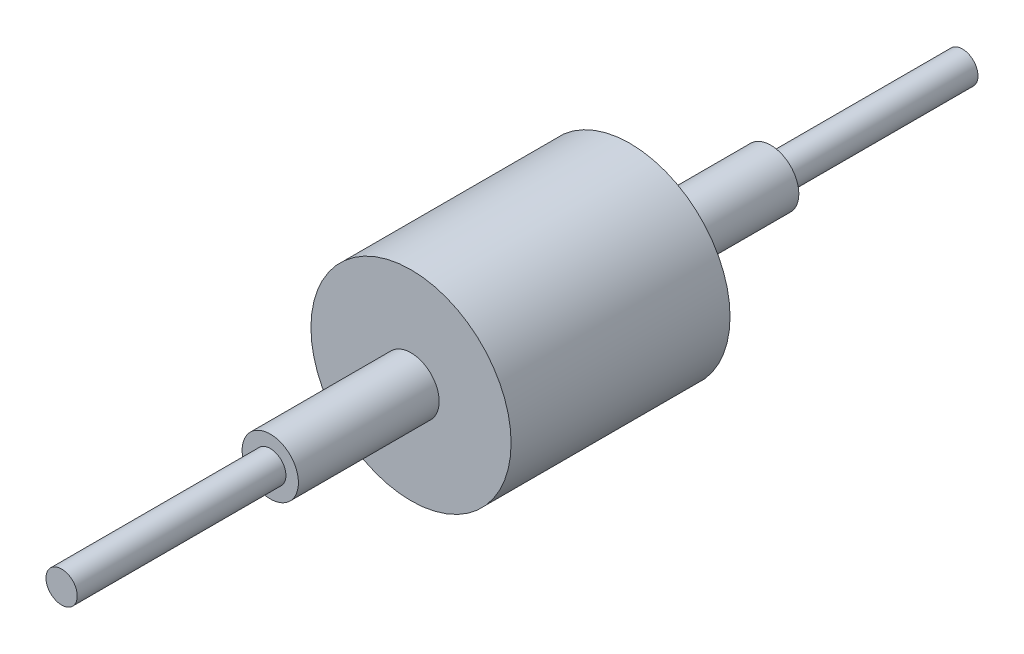
from build123d import *


with BuildPart() as part:
    # Sketch1 → Revolve2 (revolve)
    with BuildSketch(Plane(origin=(0, 0, 0), x_dir=(1, 0, 0), z_dir=(0, 1, 0))):
        Polygon((12.7, -23.424204442), (12.7, 4.357045558), (3.571875, 4.357045558), (3.571875, 22.216420558), (1.984375, 22.216420558), (1.984375, 46.537904999), (0, 46.537904999), (0, 22.216420558), (0, -41.283579442), (0, -67.762095001), (1.984375, -67.762095001), (1.984375, -41.283579442), (3.571875, -41.283579442), (3.571875, -23.424204442), align=None)
    revolve(axis=Axis((0, 0, 1000), (0, 0, -1)))


solid = part.part
